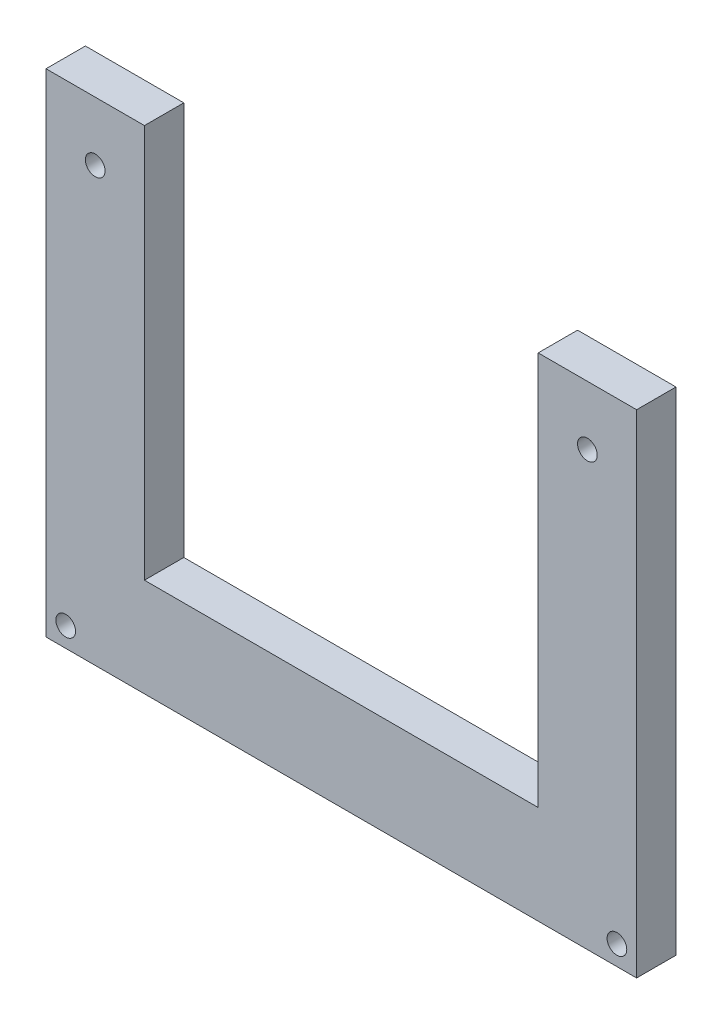
from build123d import *

# Parameters (mm, degrees)
BOSS_EXTRUDE1_DEPTH = 20
CUT_EXTRUDE1_REACH  = 393.024
SKETCH2_R           = 5
CUT_EXTRUDE2_REACH  = 393.024
SKETCH3_R           = 5


with BuildPart() as part:
    # Sketch1 → Boss-Extrude1 (new body)
    with BuildSketch(Plane.XY):
        Polygon((0, 0), (0, -250), (300, -250), (300, 0), (250, 0), (250, -200), (50, -200), (50, 0), align=None)
    extrude(amount=BOSS_EXTRUDE1_DEPTH)

    # Sketch2 → Cut-Extrude1 (cut, up to next)
    with BuildSketch(Plane.XY.offset(20), mode=Mode.PRIVATE) as cut_extrude1_sk1:
        with Locations((25, -30)):
            Circle(SKETCH2_R)
    cut_extrude1_tool1 = extrude(cut_extrude1_sk1.sketch, amount=-CUT_EXTRUDE1_REACH, mode=Mode.PRIVATE) & part.part
    # Sketch2 → Cut-Extrude1 (cut, up to next)
    with BuildSketch(Plane.XY.offset(20), mode=Mode.PRIVATE) as cut_extrude1_sk2:
        with Locations((275, -30)):
            Circle(SKETCH2_R)
    cut_extrude1_tool2 = extrude(cut_extrude1_sk2.sketch, amount=-CUT_EXTRUDE1_REACH, mode=Mode.PRIVATE) & part.part
    add(cut_extrude1_tool1.solids().sort_by_distance((25, -30, 20))[0], mode=Mode.SUBTRACT)
    add(cut_extrude1_tool2.solids().sort_by_distance((275, -30, 20))[0], mode=Mode.SUBTRACT)

    # Sketch3 → Cut-Extrude2 (cut, up to next)
    with BuildSketch(Plane(origin=(0, 0, 0), x_dir=(-1, 0, 0), z_dir=(0, 0, -1)), mode=Mode.PRIVATE) as cut_extrude2_sk1:
        with Locations((-290, -240)):
            Circle(SKETCH3_R)
    cut_extrude2_tool1 = extrude(cut_extrude2_sk1.sketch, amount=-CUT_EXTRUDE2_REACH, mode=Mode.PRIVATE) & part.part
    # Sketch3 → Cut-Extrude2 (cut, up to next)
    with BuildSketch(Plane(origin=(0, 0, 0), x_dir=(-1, 0, 0), z_dir=(0, 0, -1)), mode=Mode.PRIVATE) as cut_extrude2_sk2:
        with Locations(Location((-10, -240, 0), (0, 0, 180))):
            Circle(SKETCH3_R)
    cut_extrude2_tool2 = extrude(cut_extrude2_sk2.sketch, amount=-CUT_EXTRUDE2_REACH, mode=Mode.PRIVATE) & part.part
    add(cut_extrude2_tool1.solids().sort_by_distance((290, -240, 0))[0], mode=Mode.SUBTRACT)
    add(cut_extrude2_tool2.solids().sort_by_distance((10, -240, 0))[0], mode=Mode.SUBTRACT)


solid = part.part
